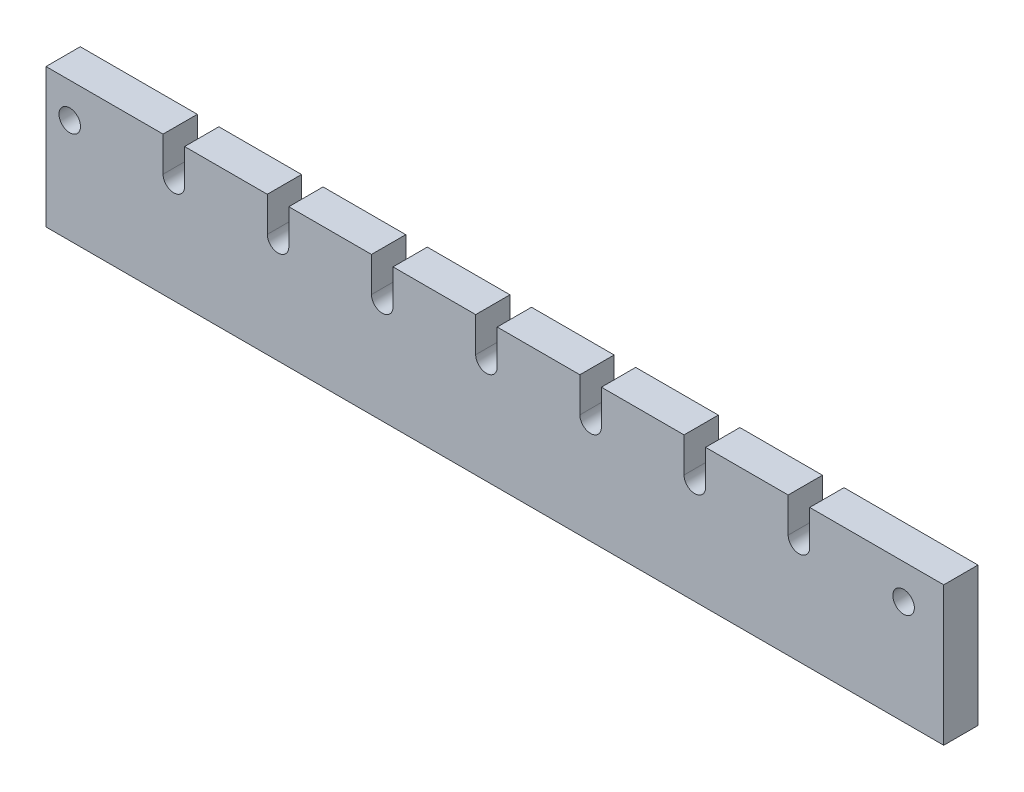
from build123d import *

# Parameters (mm, degrees)
SKETCH1_W               = 77.514562268
SKETCH1_H               = 12
BOSS_EXTRUDE1_DEPTH     = 1.47955
CUT_EXTRUDE1_DEPTH      = 93.316205492
CUT_EXTRUDE1_DEPTH_BACK = 93.316205492
SKETCH3_R               = 0.92964


with BuildPart() as part:
    # Sketch1 → Boss-Extrude1 (new, symmetric)
    with BuildSketch(Plane.XY):
        with Locations((-53.29272171, -0.35)):
            Rectangle(SKETCH1_W, SKETCH1_H)
    extrude(amount=BOSS_EXTRUDE1_DEPTH, both=True)

    # Sketch3 → Cut-Extrude1 (cut, two sides: drawn at the far end of the back side and taken through both)
    with BuildSketch(Plane(origin=(0, 0, -1.47955), x_dir=(-1, 0, 0), z_dir=(0, 0, -1)).offset(-CUT_EXTRUDE1_DEPTH_BACK)):
        with Locations((18.000000576, 2.65)):
            Circle(SKETCH3_R)
        with Locations((90.00000288, 2.65)):
            Circle(SKETCH3_R)
        with BuildLine():
            Line((26.1081454, 2.65), (26.1081454, 5.65))
            Line((26.1081454, 5.65), (27.9674254, 5.65))
            Line((27.9674254, 5.65), (27.9674254, 2.65))
            ThreePointArc((27.9674254, 2.65), (27.0377854, 1.72036), (26.1081454, 2.65))
        make_face()
        with BuildLine():
            Line((35.09872244, 2.65), (35.09872244, 5.65))
            Line((35.09872244, 5.65), (36.95800244, 5.65))
            Line((36.95800244, 5.65), (36.95800244, 2.65))
            ThreePointArc((36.95800244, 2.65), (36.02836244, 1.72036), (35.09872244, 2.65))
        make_face()
        with BuildLine():
            Line((44.093057534, 2.65), (44.093057534, 5.65))
            Line((44.093057534, 5.65), (45.952337534, 5.65))
            Line((45.952337534, 5.65), (45.952337534, 2.65))
            ThreePointArc((45.952337534, 2.65), (45.022697534, 1.72036), (44.093057534, 2.65))
        make_face()
        with BuildLine():
            Line((53.089277696, 2.65), (53.089277696, 5.65))
            Line((53.089277696, 5.65), (54.948557696, 5.65))
            Line((54.948557696, 5.65), (54.948557696, 2.65))
            ThreePointArc((54.948557696, 2.65), (54.018917696, 1.72036), (53.089277696, 2.65))
        make_face()
        with BuildLine():
            Line((62.086576691, 2.65), (62.086576691, 5.65))
            Line((62.086576691, 5.65), (63.945856691, 5.65))
            Line((63.945856691, 5.65), (63.945856691, 2.65))
            ThreePointArc((63.945856691, 2.65), (63.016216691, 1.72036), (62.086576691, 2.65))
        make_face()
        with BuildLine():
            Line((71.084550518, 2.65), (71.084550518, 5.65))
            Line((71.084550518, 5.65), (72.943830518, 5.65))
            Line((72.943830518, 5.65), (72.943830518, 2.65))
            ThreePointArc((72.943830518, 2.65), (72.014190518, 1.72036), (71.084550518, 2.65))
        make_face()
        with BuildLine():
            Line((80.08297445, 2.65), (80.08297445, 5.65))
            Line((80.08297445, 5.65), (81.94225445, 5.65))
            Line((81.94225445, 5.65), (81.94225445, 2.65))
            ThreePointArc((81.94225445, 2.65), (81.01261445, 1.72036), (80.08297445, 2.65))
        make_face()
    extrude(amount=CUT_EXTRUDE1_DEPTH + CUT_EXTRUDE1_DEPTH_BACK, mode=Mode.SUBTRACT)


solid = part.part
